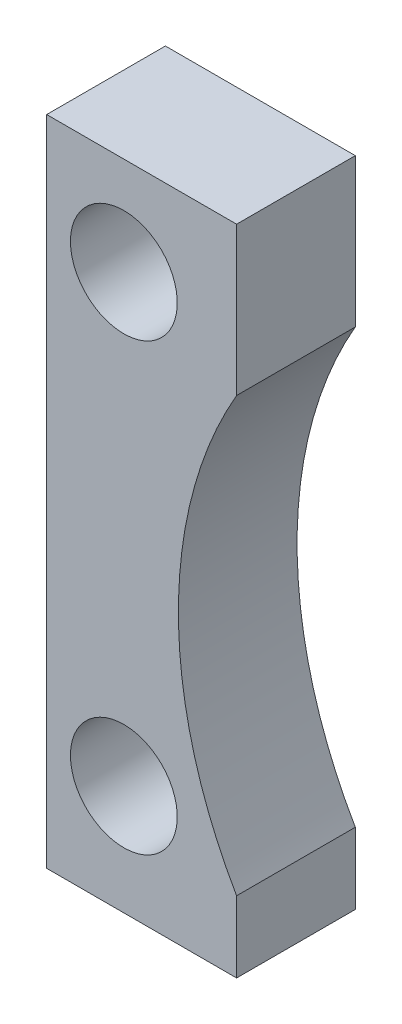
from build123d import *

# Parameters (mm, degrees)
Y_KSEKLIK_EKSTR_ZYON1_DEPTH = 10
IZIM2_R                     = 9
KES_EKSTR_ZYON1_DEPTH       = 117.292734081


with BuildPart() as part:
    # Çizim1 → Yükseklik-Ekstrüzyon1 (new, symmetric)
    with BuildSketch(Plane.XY):
        with BuildLine():
            Line((0, 110), (32, 110))
            Line((32, 110), (32, 85))
            ThreePointArc((32, 85), (22.190316578, 48.5), (32, 12))
            Line((32, 12), (32, 0))
            Line((32, 0), (0, 0))
            Line((0, 0), (0, 110))
        make_face()
    extrude(amount=Y_KSEKLIK_EKSTR_ZYON1_DEPTH, both=True)

    # Çizim2 → Kes-Ekstrüzyon1 (cut, through all)
    with BuildSketch(Plane(origin=(0, 0, -10), x_dir=(-1, 0, 0), z_dir=(0, 0, -1))):
        with Locations((-13, 93.5)):
            Circle(IZIM2_R)
        with Locations((-13, 18.5)):
            Circle(IZIM2_R)
    extrude(amount=-KES_EKSTR_ZYON1_DEPTH, mode=Mode.SUBTRACT)


solid = part.part
